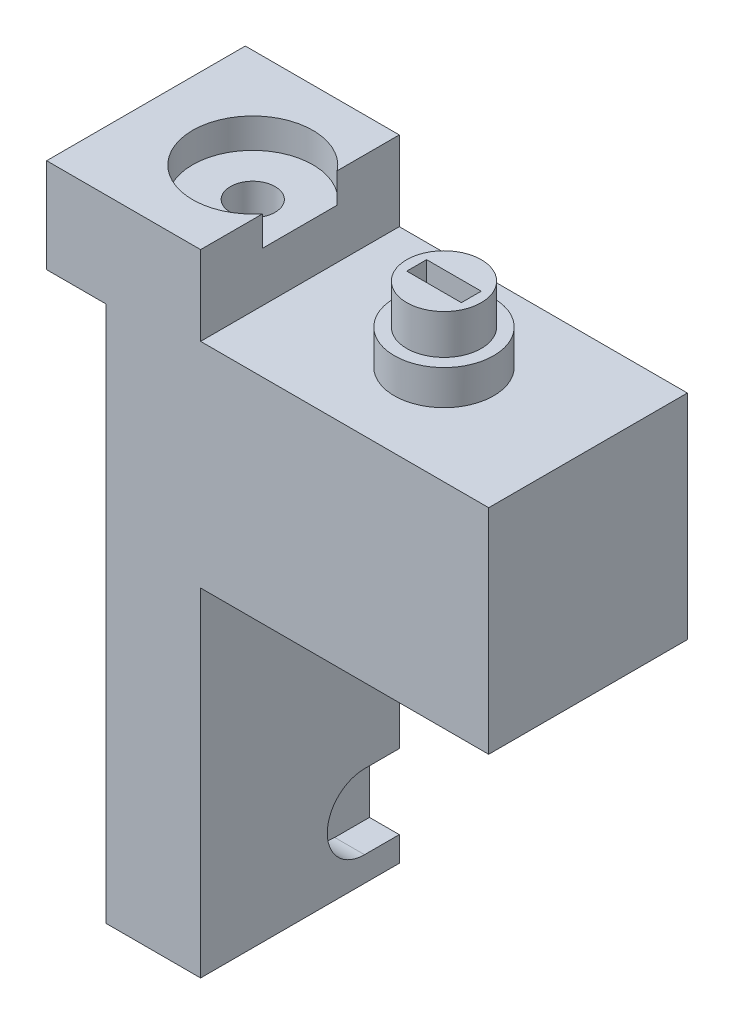
from build123d import *

# Parameters (mm, degrees)
SKETCH1_W           = 14.732
SKETCH1_H           = 10.922
BOSS_EXTRUDE1_DEPTH = 10.16
SKETCH2_R           = 1.143
CUT_EXTRUDE1_DEPTH  = 40.068139551
CUT_EXTRUDE2_DEPTH  = 1.524
CUT_EXTRUDE5_START  = -1.524
SKETCH5_R           = 1.143
CUT_EXTRUDE5_DEPTH  = 1.524
SKETCH6_R           = 2.54
BOSS_EXTRUDE2_DEPTH = 1.778
SKETCH7_R           = 1.905
BOSS_EXTRUDE3_DEPTH = 2.032
SKETCH9_W           = 2.794
SKETCH9_H           = 1.016
CUT_EXTRUDE6_DEPTH  = 2.032


with BuildPart() as part:
    # Sketch1 → Boss-Extrude1 (new body)
    with BuildSketch(Plane.XY):
        with Locations((12.192, 22.733)):
            Rectangle(SKETCH1_W, SKETCH1_H)
        Polygon((-3.048, 27.432), (0, 27.432), (0, 0), (4.826, 0), (4.826, 32.258), (-3.048, 32.258), align=None)
    extrude(amount=-BOSS_EXTRUDE1_DEPTH)

    # Sketch2 → Cut-Extrude1 (cut, through all)
    with BuildSketch(Plane(origin=(0, 0, 0), x_dir=(-1, 0, 0), z_dir=(0, -1, 0))):
        with Locations(Location((-2.413, 5.08, 0), (0, 0, 90))):
            Circle(SKETCH2_R)
    extrude(amount=-CUT_EXTRUDE1_DEPTH, mode=Mode.SUBTRACT)

    # Sketch3 → Cut-Extrude2 (cut)
    with BuildSketch(Plane(origin=(4.826, 0, 0), x_dir=(0, 0, -1), z_dir=(1, 0, 0))):
        with BuildLine():
            Line((10.16, 1.27), (8.382, 1.27))
            ThreePointArc((8.382, 1.27), (6.477, 3.175), (8.382, 5.08))
            Line((8.382, 5.08), (10.16, 5.08))
            Line((10.16, 5.08), (10.16, 1.27))
        make_face()
    extrude(amount=-CUT_EXTRUDE2_DEPTH, mode=Mode.SUBTRACT)

    # Sketch5 → Cut-Extrude5 (cut)
    with BuildSketch(Plane(origin=(0, 32.258, 0), x_dir=(1, 0, 0), z_dir=(0, 1, 0)).offset(CUT_EXTRUDE5_START)):
        with BuildLine():
            Line((4.826, 3.175), (4.826, 5.08))
            Line((4.826, 5.08), (4.826, 6.985))
            ThreePointArc((4.826, 6.985), (-0.661344483, 5.08), (4.826, 3.175))
        make_face()
        with Locations(Location((2.413, 5.08, 0), (0, 0, 90))):
            Circle(SKETCH5_R, mode=Mode.SUBTRACT)
    extrude(amount=CUT_EXTRUDE5_DEPTH, mode=Mode.SUBTRACT)

    # Sketch6 → Boss-Extrude2 (add)
    with BuildSketch(Plane(origin=(0, 28.194, 0), x_dir=(1, 0, 0), z_dir=(0, 1, 0))):
        with Locations(Location((12.192, 5.08, 0), (0, 0, 90))):
            Circle(SKETCH6_R)
    extrude(amount=BOSS_EXTRUDE2_DEPTH)

    # Sketch7 → Boss-Extrude3 (add)
    with BuildSketch(Plane(origin=(0, 29.972, 0), x_dir=(1, 0, 0), z_dir=(0, 1, 0))):
        with Locations(Location((12.192, 5.08, 0), (0, 0, 270))):
            Circle(SKETCH7_R)
    extrude(amount=BOSS_EXTRUDE3_DEPTH)

    # Sketch9 → Cut-Extrude6 (cut)
    with BuildSketch(Plane(origin=(0, 32.004, 0), x_dir=(1, 0, 0), z_dir=(0, 1, 0))):
        with Locations((12.192, 5.08)):
            Rectangle(SKETCH9_W, SKETCH9_H)
    extrude(amount=-CUT_EXTRUDE6_DEPTH, mode=Mode.SUBTRACT)


solid = part.part
